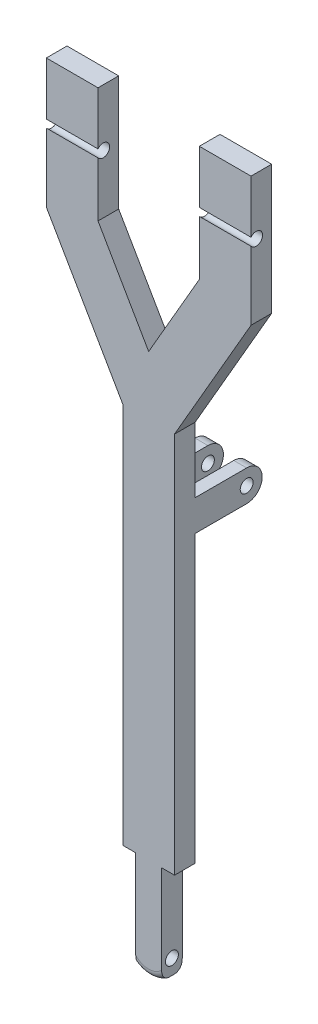
from build123d import *

# Parameters (mm, degrees)
BOSS_EXTRU_1_DEPTH      = 40
ENL_V_MAT_EXTRU_2_DEPTH = 972.24221049
ESQUISSE3_R             = 12.5
ENL_V_MAT_EXTRU_3_DEPTH = 50
CONG_1_R                = 15
ESQUISSE6_R             = 12.5
BOSS_EXTRU_2_DEPTH      = 50
ENL_V_MAT_EXTRU_4_DEPTH = 25
ESQUISSE7_R             = 12.5
ENL_V_MAT_EXTRU_5_DEPTH = 1038.379889384


with BuildPart() as part:
    # Esquisse1 → Boss.-Extru.1 (new body)
    with BuildSketch(Plane.XY):
        with BuildLine():
            Line((-50, -13.397459622), (-50, -900))
            ThreePointArc((-50, -900), (0, -950), (50, -900))
            Line((50, -900), (50, -13.397459622))
            Line((50, -13.397459622), (43.301270189, -25))
            ThreePointArc((43.301270189, -25), (0, -50), (-43.301270189, -25))
            Line((-43.301270189, -25), (-50, -13.397459622))
        make_face()
        with BuildLine():
            Line((-50, 0), (-50, -13.397459622))
            Line((-50, -13.397459622), (-43.301270189, -25))
            ThreePointArc((-43.301270189, -25), (0, -50), (43.301270189, -25))
            Line((43.301270189, -25), (50, -13.397459622))
            Line((50, -13.397459622), (50, 0))
            ThreePointArc((50, 0), (48.296291314, 12.940952255), (43.301270189, 25))
            ThreePointArc((43.301270189, 25), (0, 50), (-43.301270189, 25))
            ThreePointArc((-43.301270189, 25), (-48.296291314, 12.940952255), (-50, 0))
        make_face()
        with BuildLine():
            Line((-198.018765367, 242.978562467), (-50, -13.397459622))
            Line((-50, -13.397459622), (-50, 0))
            ThreePointArc((-50, 0), (-48.296291314, 12.940952255), (-43.301270189, 25))
            ThreePointArc((-43.301270189, 25), (0, 50), (43.301270189, 25))
            ThreePointArc((43.301270189, 25), (48.296291314, 12.940952255), (50, 0))
            Line((50, 0), (50, -13.397459622))
            Line((50, -13.397459622), (198.018765367, 242.978562467))
            Line((198.018765367, 242.978562467), (198.018765367, 492.978562467))
            Line((198.018765367, 492.978562467), (98.018765367, 492.978562467))
            Line((98.018765367, 492.978562467), (98.018765367, 392.978562467))
            Line((98.018765367, 392.978562467), (98.018765367, 342.978562467))
            Line((98.018765367, 342.978562467), (98.018765367, 269.773481711))
            Line((98.018765367, 269.773481711), (0, 100))
            Line((0, 100), (-98.018765367, 269.773481711))
            Line((-98.018765367, 269.773481711), (-98.018765367, 342.978562467))
            Line((-98.018765367, 342.978562467), (-98.018765367, 392.978562467))
            Line((-98.018765367, 392.978562467), (-98.018765367, 492.978562467))
            Line((-98.018765367, 492.978562467), (-198.018765367, 492.978562467))
            Line((-198.018765367, 492.978562467), (-198.018765367, 242.978562467))
        make_face()
    extrude(amount=BOSS_EXTRU_1_DEPTH)

    # Esquisse2 → Enlèv. mat.-Extru.2 (cut, through all)
    with BuildSketch(Plane(origin=(0, 0, 0), x_dir=(-1, 0, 0), z_dir=(0, 0, -1))):
        with BuildLine():
            ThreePointArc((50, -900), (43.301270189, -925), (25, -943.301270189))
            Line((25, -943.301270189), (25, -1037.943368981))
            Line((25, -1037.943368981), (50, -1037.943368981))
            Line((50, -1037.943368981), (50, -900))
        make_face()
        with BuildLine():
            ThreePointArc((-25, -943.301270189), (-43.301270189, -925), (-50, -900))
            Line((-50, -900), (-50, -1037.943368981))
            Line((-50, -1037.943368981), (-25, -1037.943368981))
            Line((-25, -1037.943368981), (-25, -943.301270189))
        make_face()
        with BuildLine():
            Line((-25, -752.632896004), (-50, -752.632896004))
            Line((-50, -752.632896004), (-50, -900))
            ThreePointArc((-50, -900), (-43.301270189, -925), (-25, -943.301270189))
            Line((-25, -943.301270189), (-25, -752.632896004))
        make_face()
        with BuildLine():
            Line((50, -752.632896004), (25, -752.632896004))
            Line((25, -752.632896004), (25, -943.301270189))
            ThreePointArc((25, -943.301270189), (43.301270189, -925), (50, -900))
            Line((50, -900), (50, -752.632896004))
        make_face()
    extrude(amount=-ENL_V_MAT_EXTRU_2_DEPTH, mode=Mode.SUBTRACT)

    # Esquisse3 → Enlèv. mat.-Extru.3 (cut)
    with BuildSketch(Plane(origin=(25, 0, 0), x_dir=(0, 0, -1), z_dir=(1, 0, 0))):
        with Locations((-20, -913.975598424)):
            Circle(ESQUISSE3_R)
    extrude(amount=-ENL_V_MAT_EXTRU_3_DEPTH, mode=Mode.SUBTRACT)

    # Congé1
    cong_1_edges = [part.edges().sort_by_distance(p)[0] for p in [
        (0, -950, 0),
        (0, -950, 40),
    ]]
    fillet(cong_1_edges, radius=CONG_1_R)

    # Esquisse6 → Boss.-Extru.2 (add, symmetric)
    with BuildSketch(Plane(origin=(0, 0, 0), x_dir=(0, 0, -1), z_dir=(1, 0, 0))):
        with BuildLine():
            Line((99.658431886, -139.909310173), (-10.672864852, -139.909310173))
            Line((-10.672864852, -139.909310173), (-10.672864852, -199.909310173))
            Line((-10.672864852, -199.909310173), (99.658431886, -199.909310173))
            ThreePointArc((99.658431886, -199.909310173), (129.658431886, -169.909310173), (99.658431886, -139.909310173))
        make_face()
        with Locations(Location((99.658431886, -169.909310173, 0), (0, 0, 180))):
            Circle(ESQUISSE6_R, mode=Mode.SUBTRACT)
    extrude(amount=BOSS_EXTRU_2_DEPTH, both=True)

    # Esquisse6 → Enlèv. mat.-Extru.4 (cut, symmetric)
    with BuildSketch(Plane(origin=(0, 0, 0), x_dir=(0, 0, -1), z_dir=(1, 0, 0))):
        with BuildLine():
            Line((99.658431886, -139.909310173), (-10.672864852, -139.909310173))
            Line((-10.672864852, -139.909310173), (-10.672864852, -199.909310173))
            Line((-10.672864852, -199.909310173), (99.658431886, -199.909310173))
            ThreePointArc((99.658431886, -199.909310173), (129.658431886, -169.909310173), (99.658431886, -139.909310173))
        make_face()
        with Locations(Location((99.658431886, -169.909310173, 0), (0, 0, 180))):
            Circle(ESQUISSE6_R, mode=Mode.SUBTRACT)
    extrude(amount=ENL_V_MAT_EXTRU_4_DEPTH, both=True, mode=Mode.SUBTRACT)

    # Esquisse7 → Enlèv. mat.-Extru.5 (cut, through all)
    with BuildSketch(Plane(origin=(198.018765367, 0, 0), x_dir=(0, 0, -1), z_dir=(1, 0, 0))):
        with Locations((-30, 382.978562467)):
            Circle(ESQUISSE7_R)
    extrude(amount=-ENL_V_MAT_EXTRU_5_DEPTH, mode=Mode.SUBTRACT)


solid = part.part
